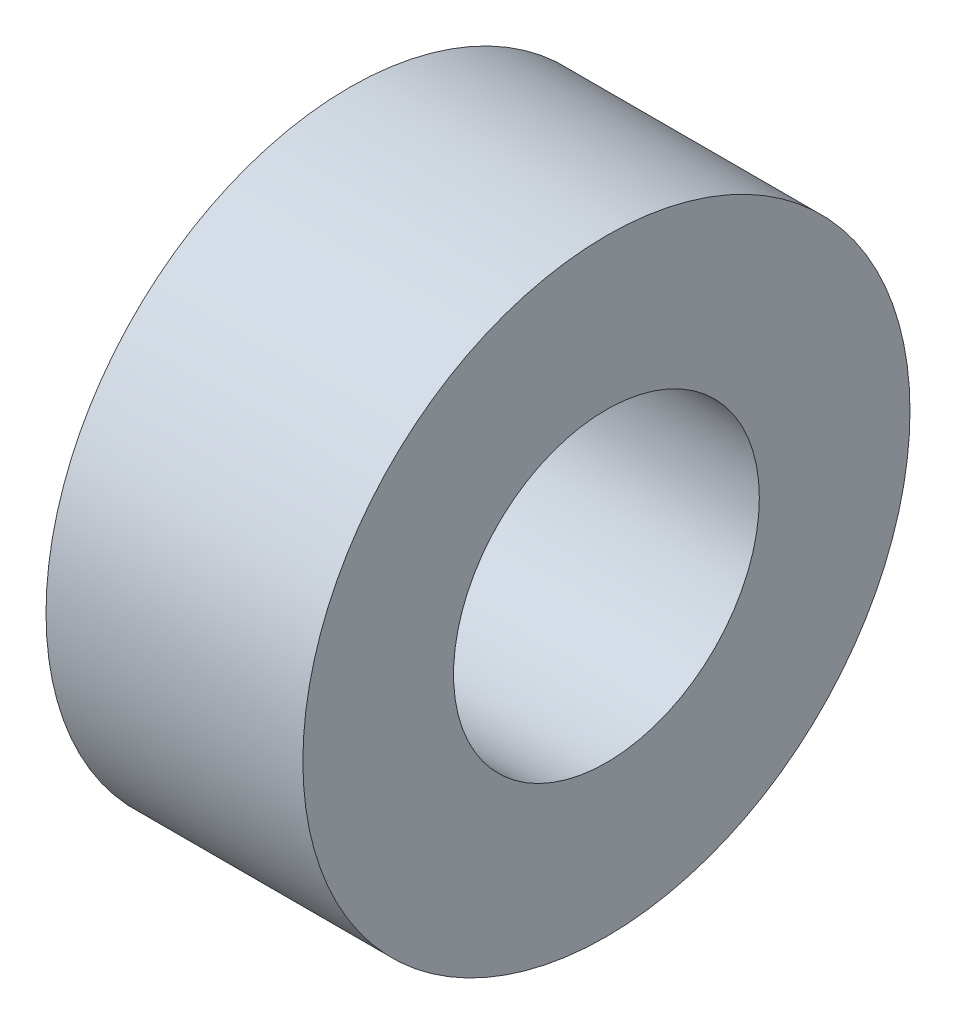
from build123d import *

# Parameters (mm, degrees)
SKETCH2_R           = 4.727157868
SKETCH2_R_2         = 2.38125
BOSS_EXTRUDE1_DEPTH = 2


with BuildPart() as part:
    # Sketch2 → Boss-Extrude1 (new, symmetric)
    with BuildSketch(Plane(origin=(0, 0, 0), x_dir=(0, 0, -1), z_dir=(1, 0, 0))):
        Circle(SKETCH2_R)
        Circle(SKETCH2_R_2, mode=Mode.SUBTRACT)
    extrude(amount=BOSS_EXTRUDE1_DEPTH, both=True)


solid = part.part
